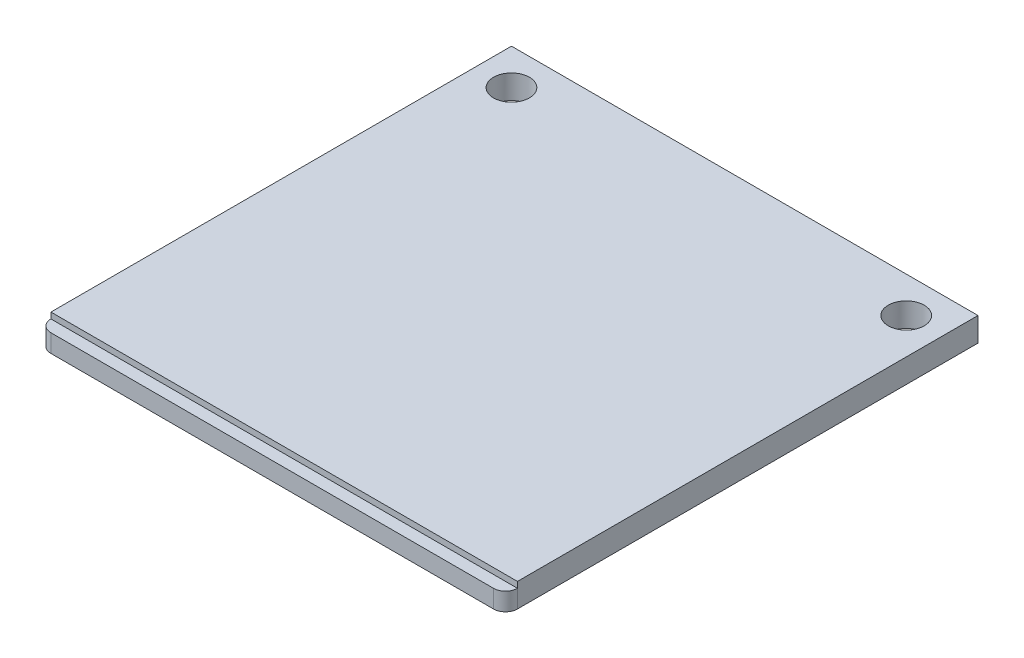
from build123d import *

# Parameters (mm, degrees)
SKIZZE1_W                       = 39
SKIZZE1_H                       = 39.5
AUFSATZ_LINEAR_AUSTRAGEN1_DEPTH = 2
SCHNITT_LINEAR_AUSTRAGEN1_REACH = 57.545
SKIZZE2_R                       = 1.5
SKIZZE3_W                       = 39
SKIZZE3_H                       = 1
SCHNITT_LINEAR_AUSTRAGEN2_DEPTH = 0.5
VERRUNDUNG1_R                   = 1


with BuildPart() as part:
    # Skizze1 → Aufsatz-Linear austragen1 (new body)
    with BuildSketch(Plane(origin=(0, 0, 0), x_dir=(1, 0, 0), z_dir=(0, 1, 0))):
        with Locations((19.5, 19.75)):
            Rectangle(SKIZZE1_W, SKIZZE1_H)
    extrude(amount=AUFSATZ_LINEAR_AUSTRAGEN1_DEPTH)

    # Skizze2 → Schnitt-Linear austragen1 (cut, up to next)
    with BuildSketch(Plane(origin=(0, 2, 0), x_dir=(1, 0, 0), z_dir=(0, 1, 0)), mode=Mode.PRIVATE) as schnitt_linear_austragen1_sk1:
        with Locations(Location((3, 36.5, 0), (0, 0, 270))):
            Circle(SKIZZE2_R)
    schnitt_linear_austragen1_tool1 = extrude(schnitt_linear_austragen1_sk1.sketch, amount=-SCHNITT_LINEAR_AUSTRAGEN1_REACH, mode=Mode.PRIVATE) & part.part
    # Skizze2 → Schnitt-Linear austragen1 (cut, up to next)
    with BuildSketch(Plane(origin=(0, 2, 0), x_dir=(1, 0, 0), z_dir=(0, 1, 0)), mode=Mode.PRIVATE) as schnitt_linear_austragen1_sk2:
        with Locations(Location((36, 36.5, 0), (0, 0, 270))):
            Circle(SKIZZE2_R)
    schnitt_linear_austragen1_tool2 = extrude(schnitt_linear_austragen1_sk2.sketch, amount=-SCHNITT_LINEAR_AUSTRAGEN1_REACH, mode=Mode.PRIVATE) & part.part
    add(schnitt_linear_austragen1_tool1.solids().sort_by_distance((3, 2, -36.5))[0], mode=Mode.SUBTRACT)
    add(schnitt_linear_austragen1_tool2.solids().sort_by_distance((36, 2, -36.5))[0], mode=Mode.SUBTRACT)

    # Skizze3 → Schnitt-Linear austragen2 (cut)
    with BuildSketch(Plane(origin=(0, 2, 0), x_dir=(1, 0, 0), z_dir=(0, 1, 0))):
        with Locations((19.5, 0.5)):
            Rectangle(SKIZZE3_W, SKIZZE3_H)
    extrude(amount=-SCHNITT_LINEAR_AUSTRAGEN2_DEPTH, mode=Mode.SUBTRACT)

    # Verrundung1
    verrundung1_edges = [part.edges().sort_by_distance(p)[0] for p in [
        (0, 0.75, 0),
        (39, 0.75, 0),
    ]]
    fillet(verrundung1_edges, radius=VERRUNDUNG1_R)


solid = part.part
